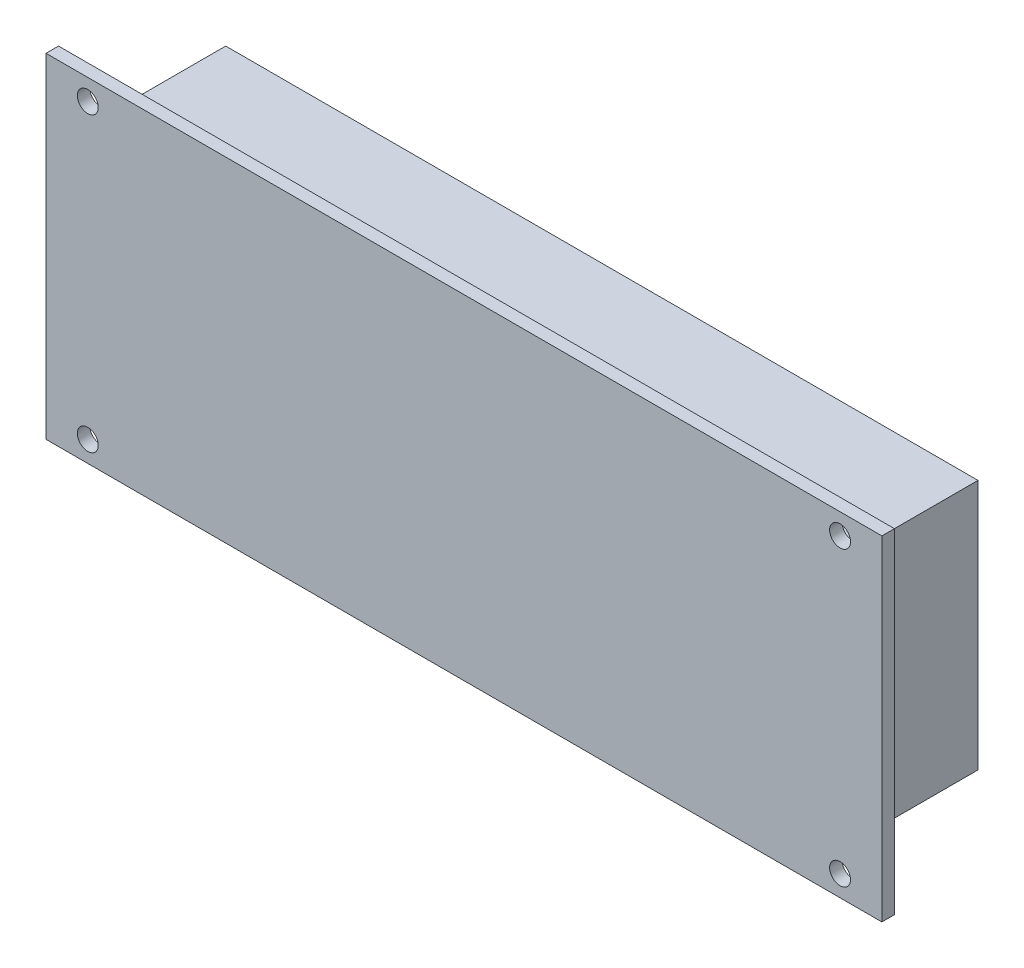
from build123d import *

# Parameters (mm, degrees)
SKETCH_1_W             = 200
SKETCH_1_H             = 80
EXTRUDE_1_DEPTH        = 3
SKETCH_2_W             = 180
SKETCH_2_H             = 60
EXTRUDE_2_DEPTH        = 30
HOLE_WIZARD_M6_1_D     = 5
HOLE_WIZARD_M6_1_DEPTH = 15
HOLE_WIZARD_M6_1_TIP   = 1.502151548


with BuildPart() as part:
    # 草图1 → 凸台-拉伸1 (new body)
    with BuildSketch(Plane.XY):
        Rectangle(SKETCH_1_W, SKETCH_1_H)
    extrude(amount=EXTRUDE_1_DEPTH)

    # 草图2 → 凸台-拉伸2 (add)
    with BuildSketch(Plane(origin=(0, 0, 0), x_dir=(-1, 0, 0), z_dir=(0, 0, -1))):
        Rectangle(SKETCH_2_W, SKETCH_2_H)
    extrude(amount=EXTRUDE_2_DEPTH)

    # M6 螺纹孔1
    with Locations(Plane(origin=(0, 0, 0), x_dir=(-1, 0, 0), z_dir=(0, 0, -1))):
        with Locations((-90, 35), (-90, -35), (90, -35), (90, 35)):
            Hole(HOLE_WIZARD_M6_1_D / 2, depth=HOLE_WIZARD_M6_1_DEPTH)
            with Locations((0, 0, -(HOLE_WIZARD_M6_1_DEPTH + HOLE_WIZARD_M6_1_TIP / 2))):  # 118° drill point
                Cone(0, HOLE_WIZARD_M6_1_D / 2, HOLE_WIZARD_M6_1_TIP, mode=Mode.SUBTRACT)


solid = part.part
